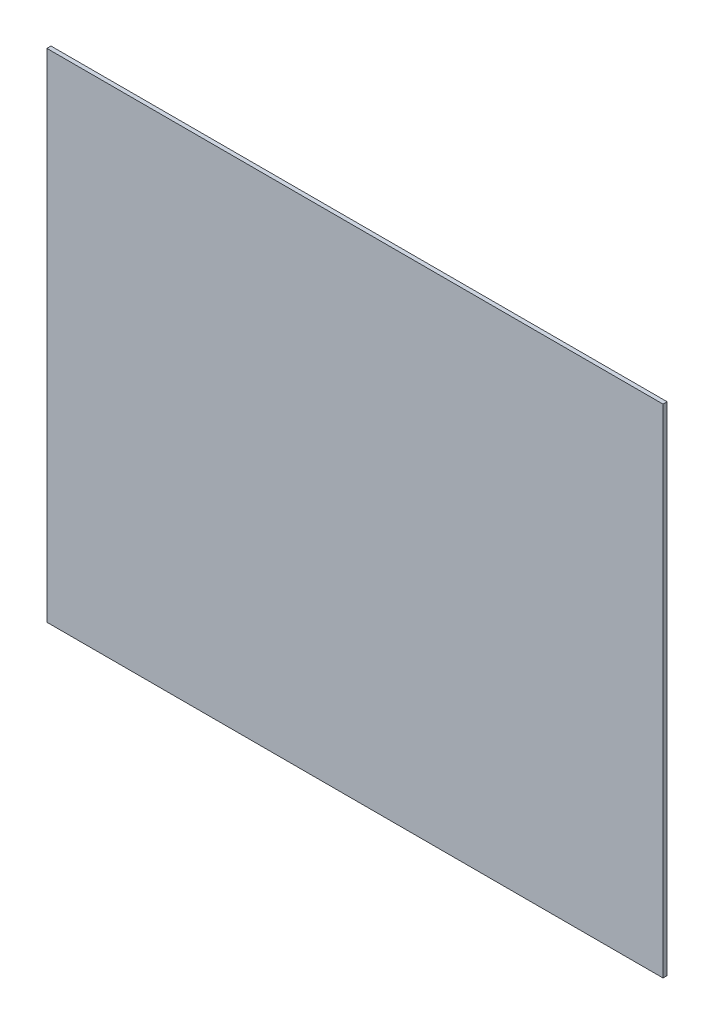
from build123d import *

# Parameters (mm, degrees)
SKETCH1_W           = 476.25
SKETCH1_H           = 384.175
BOSS_EXTRUDE1_DEPTH = 3.175


with BuildPart() as part:
    # Sketch1 → Boss-Extrude1 (new body)
    with BuildSketch(Plane.XY):
        Rectangle(SKETCH1_W, SKETCH1_H)
    extrude(amount=BOSS_EXTRUDE1_DEPTH)


solid = part.part
